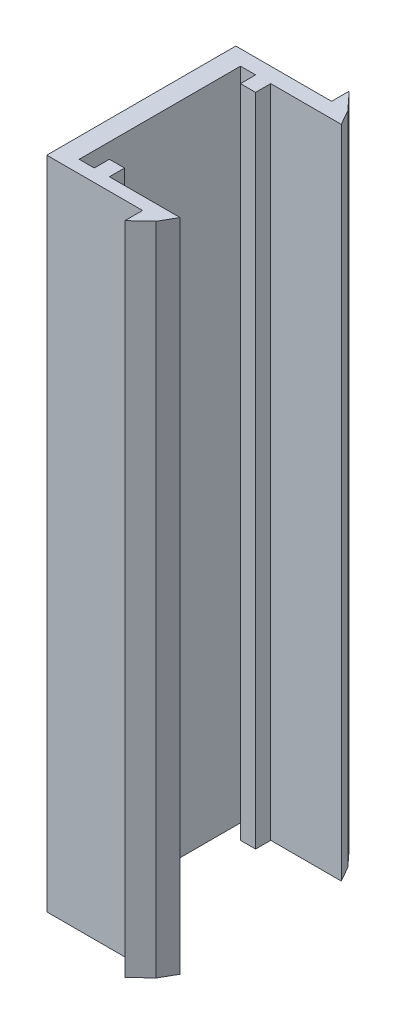
from build123d import *

# Parameters (mm, degrees)
BOSS_EXTRUDE2_DEPTH = 130


with BuildPart() as part:
    # Sketch1 → Boss-Extrude2 (new body)
    with BuildSketch(Plane(origin=(0, 0, 0), x_dir=(1, 0, 0), z_dir=(0, 1, 0))):
        Polygon((0, -3), (0, 29), (3, 29), (3, 26), (6, 26), (6, 29), (20, 29), (18.290622359, 32), (15.075355057, 35.5), (15.075355057, 32), (-3.924644943, 32), (-3.924644943, -5.5), (15.075355057, -5.5), (15.075355057, -9), (18.290622359, -6), (20, -3), (6, -3), (6, 0), (3, 0), (3, -3), align=None)
    extrude(amount=BOSS_EXTRUDE2_DEPTH)


solid = part.part
